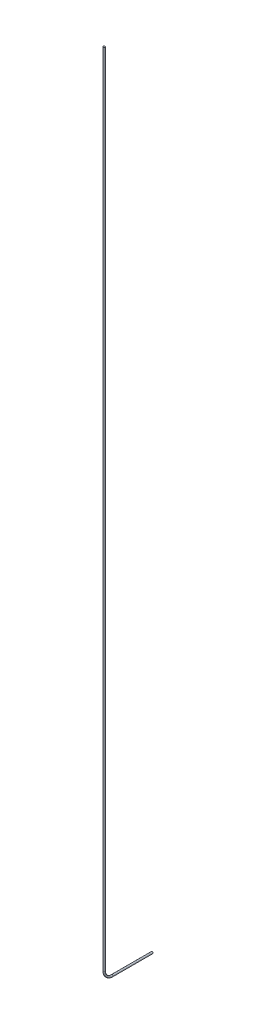
from build123d import *

# Parameters (mm, degrees)
SKETCH_1_R      = 0.57
EXTRUDE_1_DEPTH = 20
SKETCH_2_R      = 0.57


with BuildPart() as part:
    # ｽｹｯﾁ1 → ﾎﾞｽ - 押し出し1 (new body)
    with BuildSketch(Plane.XY):
        Circle(SKETCH_1_R)
    extrude(amount=EXTRUDE_1_DEPTH)

    # ｽｲｰﾌﾟ1: sweep along a path in ｽｹｯﾁ3
    with BuildLine(Plane(origin=(0, 0, 0), x_dir=(0, 0, -1), z_dir=(1, 0, 0))) as sweep_1_path:
        Line((-20, 0), (-25, 0))
        ThreePointArc((-25, 0), (-28.535533906, 1.464466094), (-30, 5))
        Line((-30, 5), (-30, 505))
    # ｽｹｯﾁ2 → ｽｲｰﾌﾟ1 (sweep)
    with BuildSketch(Plane.XY.offset(20)):
        Circle(SKETCH_2_R)
    sweep(path=sweep_1_path.line)


solid = part.part
